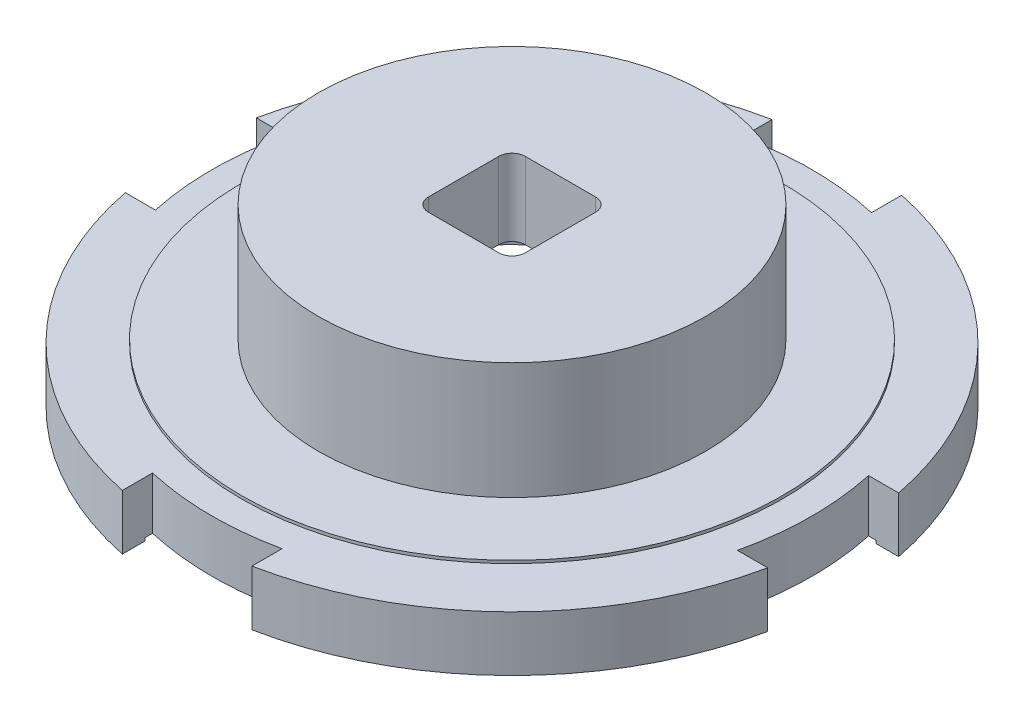
from build123d import *

# Parameters (mm, degrees)
SKETCH1_W           = 10
SKETCH1_H           = 10
BOSS_EXTRUDE2_DEPTH = 6
CUT_EXTRUDE1_DEPTH  = 3.81
SKETCH3_R           = 31.75
CUT_EXTRUDE2_DEPTH  = 0.3
SKETCH4_R           = 20.01
SKETCH4_W           = 10
SKETCH4_H           = 10
BOSS_EXTRUDE3_DEPTH = 12.065
SKETCH5_R           = 15.875
CUT_EXTRUDE3_DEPTH  = 6.35
FILLET1_R           = 1.3716
SKETCH6_R           = 54.970137174
SKETCH6_R_2         = 27.94
CUT_EXTRUDE4_DEPTH  = 0.3


with BuildPart() as part:
    # Sketch1 → Boss-Extrude2 (new body)
    with BuildSketch(Plane(origin=(0, 0, 0), x_dir=(1, 0, 0), z_dir=(0, 1, 0))):
        with BuildLine():
            Line((30.289899368, 6.5405), (33.401663967, 6.5405))
            ThreePointArc((33.401663967, 6.5405), (24.204111991, 23.929276184), (6.9215, 33.32479758))
            Line((6.9215, 33.32479758), (6.9215, 30.205115159))
            ThreePointArc((6.9215, 30.205115159), (0.195159782, 30.987385444), (-6.5405, 30.289899368))
            Line((-6.5405, 30.289899368), (-6.5405, 33.401663967))
            ThreePointArc((-6.5405, 33.401663967), (-23.929276184, 24.204111991), (-33.32479758, 6.9215))
            Line((-33.32479758, 6.9215), (-30.205115159, 6.9215))
            ThreePointArc((-30.205115159, 6.9215), (-30.987385444, 0.195159782), (-30.289899368, -6.5405))
            Line((-30.289899368, -6.5405), (-33.401663967, -6.5405))
            ThreePointArc((-33.401663967, -6.5405), (-24.204111991, -23.929276184), (-6.9215, -33.32479758))
            Line((-6.9215, -33.32479758), (-6.9215, -30.205115159))
            ThreePointArc((-6.9215, -30.205115159), (-0.195159782, -30.987385444), (6.5405, -30.289899368))
            Line((6.5405, -30.289899368), (6.5405, -33.401663967))
            ThreePointArc((6.5405, -33.401663967), (23.929276184, -24.204111991), (33.32479758, -6.9215))
            Line((33.32479758, -6.9215), (30.205115159, -6.9215))
            ThreePointArc((30.205115159, -6.9215), (30.987385444, -0.195159782), (30.289899368, 6.5405))
        make_face()
        Rectangle(SKETCH1_W, SKETCH1_H, mode=Mode.SUBTRACT)
    extrude(amount=BOSS_EXTRUDE2_DEPTH)

    # Sketch2 → Cut-Extrude1 (cut)
    with BuildSketch(Plane.XZ):
        with BuildLine():
            Line((17.377665752, -10.033), (-0.286554615, -40.628327152))
            ThreePointArc((-0.286554615, -40.628327152), (-2.416432138, -40.557415308), (-4.539661745, -40.374924792))
            Line((-4.539661745, -40.374924792), (8.196212586, -18.315743371))
            ThreePointArc((8.196212586, -18.315743371), (-13.440862054, 14.899247741), (17.377665752, -10.033))
        make_face()
    extrude(amount=-CUT_EXTRUDE1_DEPTH, mode=Mode.SUBTRACT)

    # Sketch3 → Cut-Extrude2 (cut)
    with BuildSketch(Plane.XZ):
        Circle(SKETCH3_R)
    extrude(amount=-CUT_EXTRUDE2_DEPTH, mode=Mode.SUBTRACT)

    # Sketch4 → Boss-Extrude3 (add)
    with BuildSketch(Plane(origin=(0, 6, 0), x_dir=(1, 0, 0), z_dir=(0, 1, 0))):
        with Locations(Location((0, 0, 0), (0, 0, 90))):
            Circle(SKETCH4_R)
        Rectangle(SKETCH4_W, SKETCH4_H, mode=Mode.SUBTRACT)
    extrude(amount=BOSS_EXTRUDE3_DEPTH)

    # Sketch5 → Cut-Extrude3 (cut)
    with BuildSketch(Plane.XZ.offset(-3.81)):
        with Locations(Location((0, 0, 0), (0, 0, 270))):
            Circle(SKETCH5_R)
    extrude(amount=-CUT_EXTRUDE3_DEPTH, mode=Mode.SUBTRACT)

    # Fillet1
    fillet1_edges = [part.edges().sort_by_distance(p)[0] for p in [
        (5, 14.1125, -5),
        (-5, 14.1125, -5),
        (-5, 14.1125, 5),
        (5, 14.1125, 5),
    ]]
    fillet(fillet1_edges, radius=FILLET1_R)

    # Sketch6 → Cut-Extrude4 (cut)
    with BuildSketch(Plane(origin=(0, 6, 0), x_dir=(1, 0, 0), z_dir=(0, 1, 0))):
        Circle(SKETCH6_R)
        with Locations(Location((0, 0, 0), (0, 0, 270))):
            Circle(SKETCH6_R_2, mode=Mode.SUBTRACT)
    extrude(amount=-CUT_EXTRUDE4_DEPTH, mode=Mode.SUBTRACT)


solid = part.part
